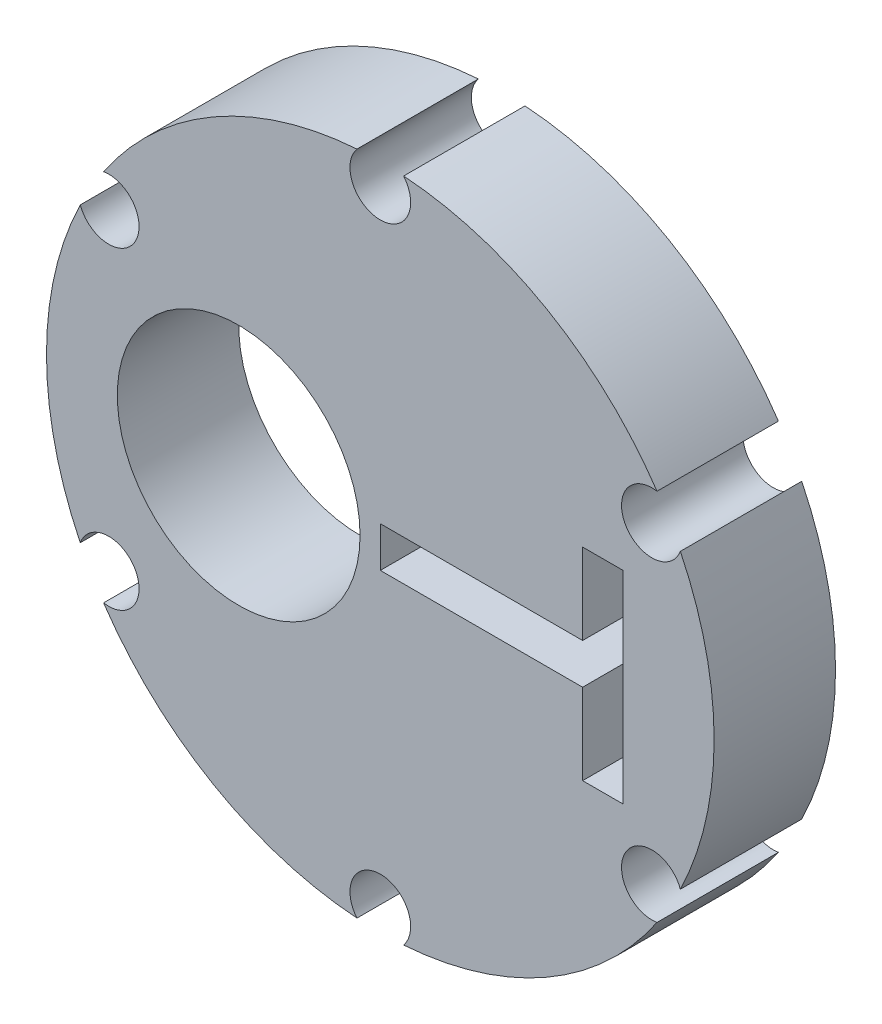
from build123d import *

# Parameters (mm, degrees)
SKETCH1_R           = 16.5
BOSS_EXTRUDE1_DEPTH = 6
SKETCH2_R           = 1.5
CUT_EXTRUDE1_DEPTH  = 25.093567606
SKETCH3_R           = 6
CUT_EXTRUDE2_DEPTH  = 25.065971427
CUT_EXTRUDE3_DEPTH  = 25.065971427


with BuildPart() as part:
    # Sketch1 → Boss-Extrude1 (new body)
    with BuildSketch(Plane.XY):
        Circle(SKETCH1_R)
    extrude(amount=BOSS_EXTRUDE1_DEPTH)

    # Sketch2 → Cut-Extrude1 (cut, through all)
    with BuildSketch(Plane.XY.offset(6)):
        with Locations((0, 15.5)):
            Circle(SKETCH2_R)
        with Locations((13.423393759, 7.75)):
            Circle(SKETCH2_R)
        with Locations((13.423393759, -7.75)):
            Circle(SKETCH2_R)
        with Locations((0, -15.5)):
            Circle(SKETCH2_R)
        with Locations((-13.423393759, -7.75)):
            Circle(SKETCH2_R)
        with Locations((-13.423393759, 7.75)):
            Circle(SKETCH2_R)
    extrude(amount=-CUT_EXTRUDE1_DEPTH, mode=Mode.SUBTRACT)

    # Sketch3 → Cut-Extrude2 (cut, through all)
    with BuildSketch(Plane.XY.offset(6)):
        with Locations((-7, 0)):
            Circle(SKETCH3_R)
    extrude(amount=-CUT_EXTRUDE2_DEPTH, mode=Mode.SUBTRACT)

    # Sketch5 → Cut-Extrude3 (cut, through all)
    with BuildSketch(Plane.XY.offset(6)):
        Polygon((12, 5), (10, 5), (10, 1), (0, 1), (0, -1), (10, -1), (10, -5), (12, -5), align=None)
    extrude(amount=-CUT_EXTRUDE3_DEPTH, mode=Mode.SUBTRACT)


solid = part.part
